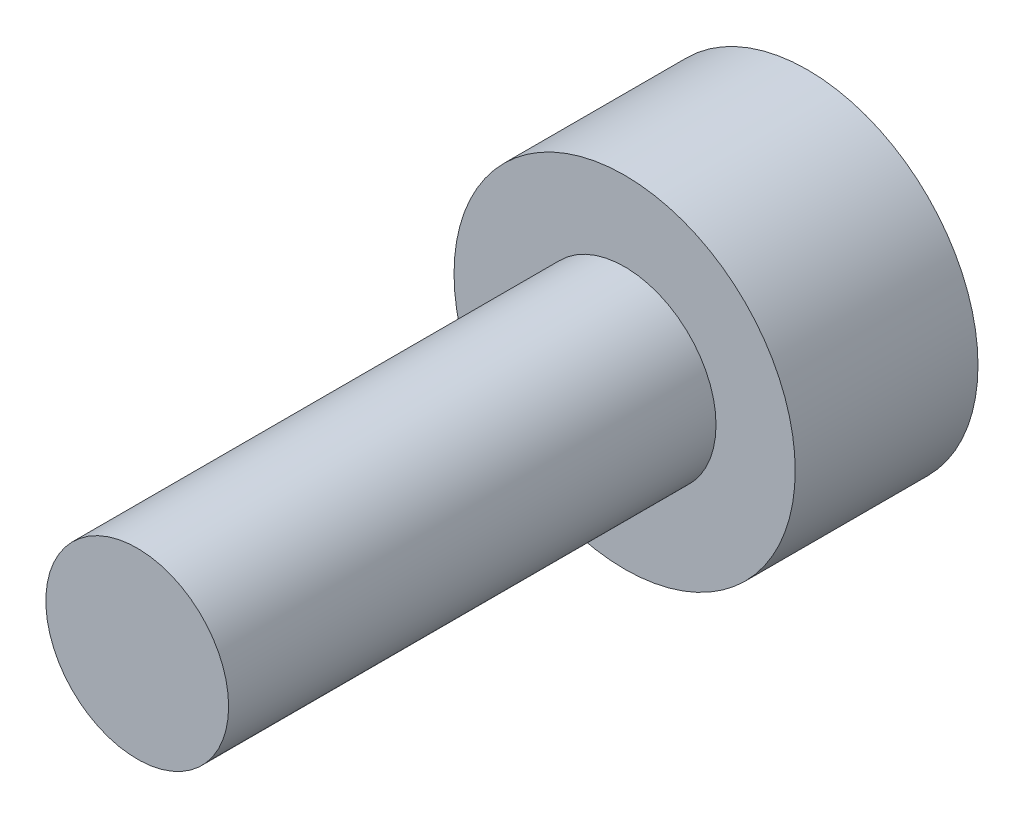
from build123d import *

# Parameters (mm, degrees)
HEAD_START       = -3
SKETCH1_R        = 2.8
HEAD_DEPTH       = 3
SKETCH2_R        = 1.5
SHANK_DEPTH      = 8
HEX_START        = -3.2
HEX_SOCKET_DEPTH = 1.8


with BuildPart() as part:
    # Sketch1 → Head (new body)
    with BuildSketch(Plane.XY.offset(HEAD_START)):
        Circle(SKETCH1_R)
    extrude(amount=HEAD_DEPTH)

    # Sketch2 → Shank (add)
    with BuildSketch(Plane.XY):
        Circle(SKETCH2_R)
    extrude(amount=SHANK_DEPTH)

    # Sketch3 → Hex socket (cut)
    with BuildSketch(Plane.XY.offset(HEX_START)):
        Polygon((1.25, 0.721687836), (0, 1.443375673), (-1.25, 0.721687836), (-1.25, -0.721687836), (0, -1.443375673), (1.25, -0.721687836), align=None)
    extrude(amount=HEX_SOCKET_DEPTH, mode=Mode.SUBTRACT)


solid = part.part
